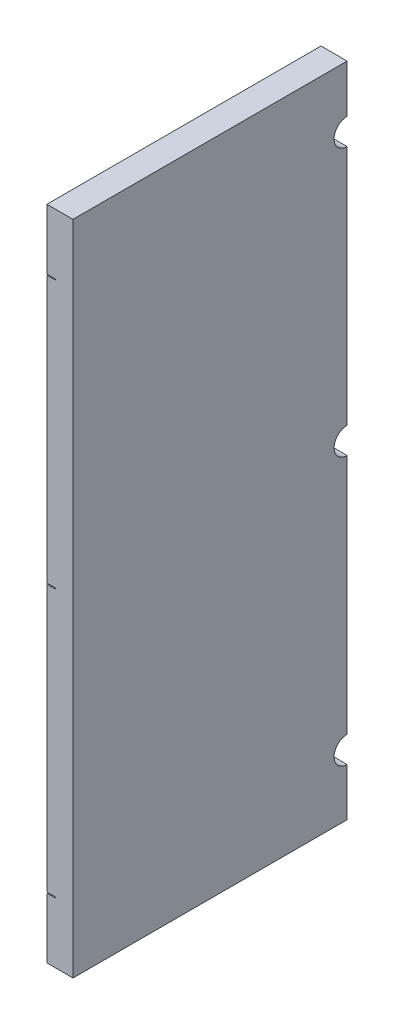
from build123d import *

# Parameters (mm, degrees)
SKETCH_1_W                                     = 3
SKETCH_1_H                                     = 74
EXTRUDE_1_DEPTH                                = 31.5
SKETCH_2_W                                     = 3
SKETCH_2_H                                     = 1.5
SIDE_REAR_EXTENSION_1P5MM_DEPTH                = 31.5
SKETCH_3_R                                     = 1.5
SIDE_TOP_EDGE_MAGNET_POCKETS_D3_DEPTH1_3_DEPTH = 1
SIDE_BOTTOM_EDGE_SEMICIRCLES_D3_THROUGH_DEPTH  = 4


with BuildPart() as part:
    # Эскиз1 → Бобышка-Вытянуть1 (new body)
    with BuildSketch(Plane.XY):
        with Locations((1.5, 37)):
            Rectangle(SKETCH_1_W, SKETCH_1_H)
    extrude(amount=EXTRUDE_1_DEPTH)

    # Эскиз2 → side_rear_extension_1p5mm (add)
    with BuildSketch(Plane.XY):
        with Locations((1.5, 74.75)):
            Rectangle(SKETCH_2_W, SKETCH_2_H)
    extrude(amount=SIDE_REAR_EXTENSION_1P5MM_DEPTH)

    # Эскиз3 → side_top_edge_magnet_pockets_D3_depth1_3x (cut)
    with BuildSketch(Plane.ZY):
        with Locations((30.001, 7)):
            Circle(SKETCH_3_R)
        with Locations((30.001, 37.75)):
            Circle(SKETCH_3_R)
        with Locations((30.001, 68.5)):
            Circle(SKETCH_3_R)
    extrude(amount=-SIDE_TOP_EDGE_MAGNET_POCKETS_D3_DEPTH1_3_DEPTH, mode=Mode.SUBTRACT)

    # Эскиз4 → side_bottom_edge_semicircles_D3_through_3x (cut)
    with BuildSketch(Plane.ZY):
        with BuildLine():
            Line((0, 5.5), (0, 8.5))
            ThreePointArc((0, 8.5), (1.5, 7), (0, 5.5))
        make_face()
        with BuildLine():
            Line((0, 36.25), (0, 39.25))
            ThreePointArc((0, 39.25), (1.5, 37.75), (0, 36.25))
        make_face()
        with BuildLine():
            Line((0, 67), (0, 70))
            ThreePointArc((0, 70), (1.5, 68.5), (0, 67))
        make_face()
    extrude(amount=-SIDE_BOTTOM_EDGE_SEMICIRCLES_D3_THROUGH_DEPTH, mode=Mode.SUBTRACT)


solid = part.part
